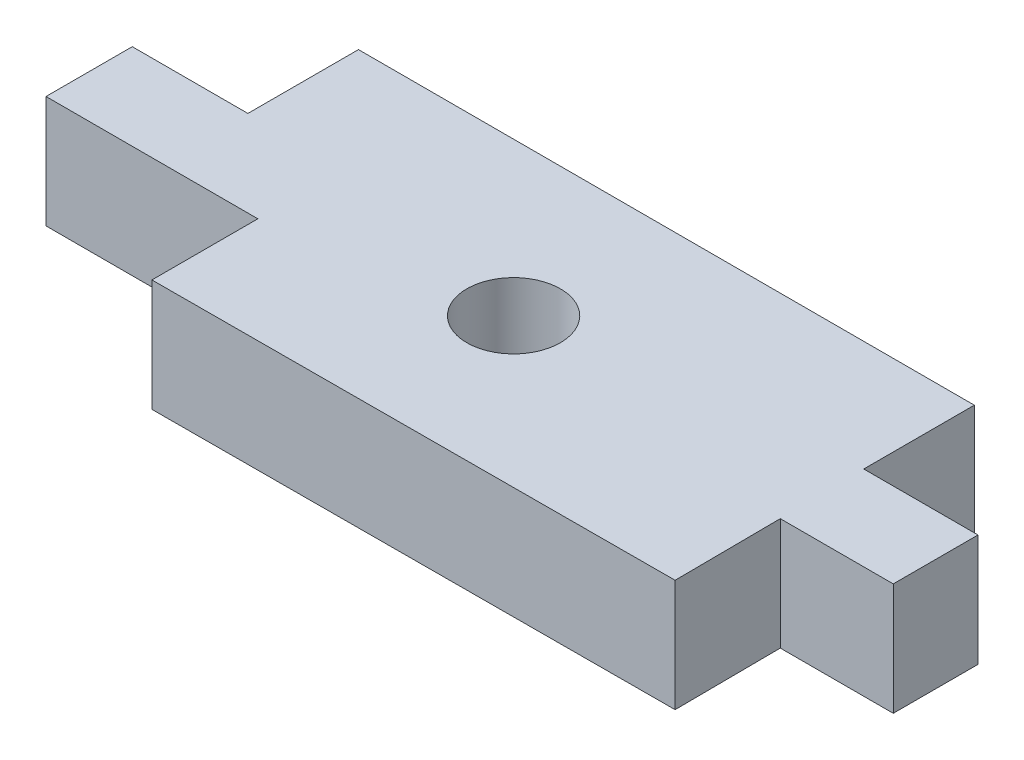
from build123d import *

# Parameters (mm, degrees)
SKETCH1_R           = 1.3250121
BOSS_EXTRUDE1_DEPTH = 3.175


with BuildPart() as part:
    # Sketch1 → Boss-Extrude1 (new body)
    with BuildSketch(Plane(origin=(0, 0, 0), x_dir=(1, 0, 0), z_dir=(0, 1, 0))):
        Polygon((112.72277638, 123.593222295), (127.497578696, 123.636436459), (127.475978696, 126.636436459), (130.675779856, 126.636436459), (130.675779856, 129.036436459), (127.440025111, 129.036436459), (127.440025111, 132.168236459), (109.997615958, 132.168236459), (109.997615958, 129.036436459), (106.722915958, 129.036436459), (106.722915958, 126.593302228), (112.722877294, 126.593302228), align=None)
        with Locations(Location((118.723210584, 127.836436459, 0), (0, 0, 270))):
            Circle(SKETCH1_R, mode=Mode.SUBTRACT)
    extrude(amount=BOSS_EXTRUDE1_DEPTH)


solid = part.part
